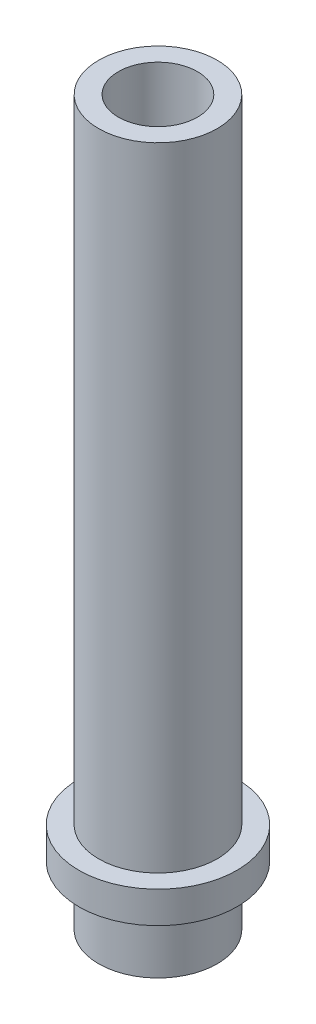
from build123d import *

# Parameters (mm, degrees)
SKETCH1_R           = 6.35
BOSS_EXTRUDE1_DEPTH = 2.54
SKETCH2_R           = 4.7625
BOSS_EXTRUDE2_DEPTH = 4.7625
BOSS_EXTRUDE3_START = 50.8
SKETCH3_R           = 4.7625
BOSS_EXTRUDE3_DEPTH = 50.8
SKETCH4_R           = 3.175
CUT_EXTRUDE1_DEPTH  = 25.4


with BuildPart() as part:
    # Sketch1 → Boss-Extrude1 (new body)
    with BuildSketch(Plane(origin=(0, 0, 0), x_dir=(1, 0, 0), z_dir=(0, 1, 0))):
        with Locations(Location((0, 0, 0), (0, 0, 270))):
            Circle(SKETCH1_R)
    extrude(amount=BOSS_EXTRUDE1_DEPTH)

    # Sketch2 → Boss-Extrude2 (add)
    with BuildSketch(Plane.XZ):
        with Locations(Location((0, 0, 0), (0, 0, 90))):
            Circle(SKETCH2_R)
    extrude(amount=BOSS_EXTRUDE2_DEPTH)

    # Sketch3 → Boss-Extrude3 (add)
    with BuildSketch(Plane(origin=(0, 2.54, 0), x_dir=(1, 0, 0), z_dir=(0, 1, 0)).offset(BOSS_EXTRUDE3_START)):
        with Locations(Location((0, 0, 0), (0, 0, 270))):
            Circle(SKETCH3_R)
    extrude(amount=-BOSS_EXTRUDE3_DEPTH)

    # Sketch4 → Cut-Extrude1 (cut)
    with BuildSketch(Plane(origin=(0, 53.34, 0), x_dir=(1, 0, 0), z_dir=(0, 1, 0))):
        with Locations(Location((0, 0, 0), (0, 0, 270))):
            Circle(SKETCH4_R)
    extrude(amount=-CUT_EXTRUDE1_DEPTH, mode=Mode.SUBTRACT)


solid = part.part
